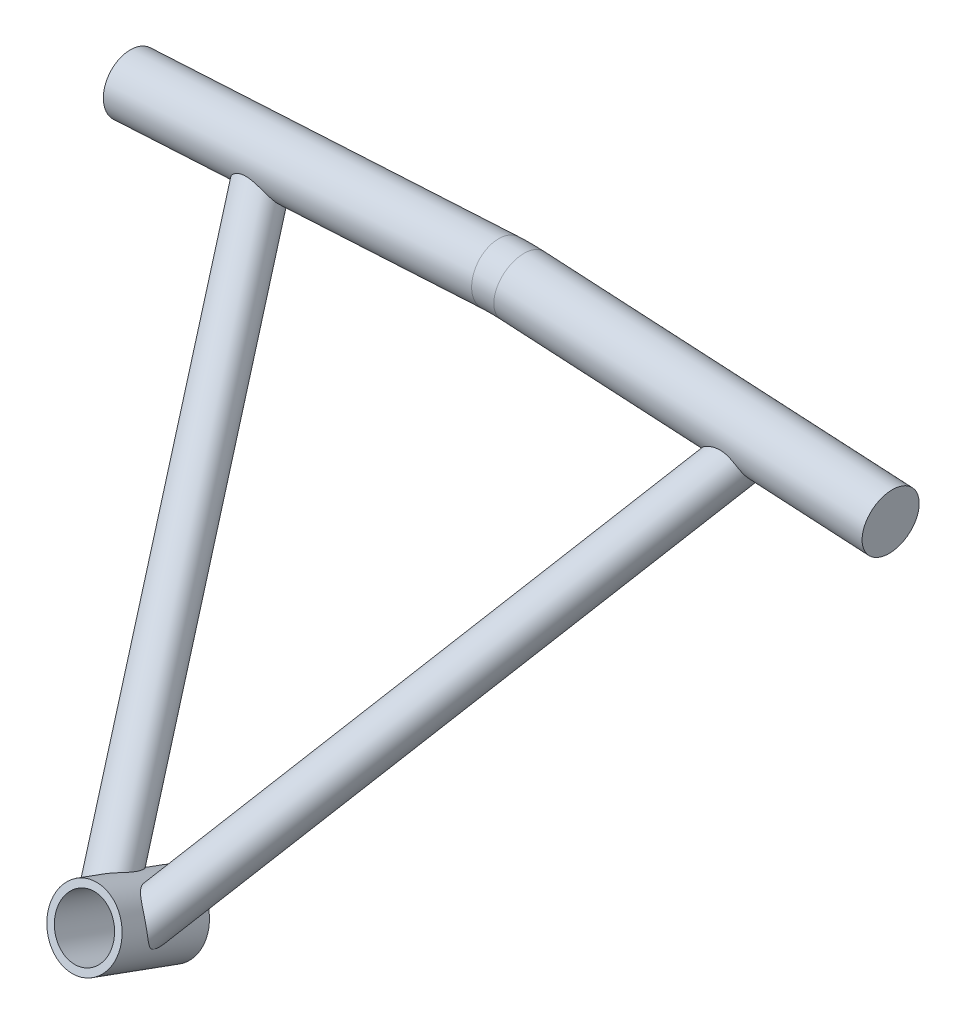
from build123d import *

# Parameters (mm, degrees)
SKETCH1_R           = 15.875
BOSS_EXTRUDE1_DEPTH = 20.701
SWEEP1_PROFILE_R    = 9.525
SWEEP2_PROFILE_R    = 9.525
CUT_EXTRUDE1_REACH  = 255.716
SKETCH2_R           = 12.7
SKETCH36_R          = 7.9375
CUT_EXTRUDE2_DEPTH  = 127
SKETCH37_R          = 7.9375
CUT_EXTRUDE3_DEPTH  = 127
SWEEP3_PROFILE_R    = 12.7


with BuildPart() as part:
    # Sketch1 → Boss-Extrude1 (new, symmetric)
    with BuildSketch(Plane(origin=(0, 0, 0), x_dir=(1, 0, 0), z_dir=(0, 0.34202014332566943, 0.9396926207859081))):
        with Locations(Location((0, 0, 0), (0, 0, 270))):
            Circle(SKETCH1_R)
    extrude(amount=BOSS_EXTRUDE1_DEPTH, both=True)

    # Sweep1: sweep along a path in Sketch4
    with BuildLine(Plane(origin=(0, 3.144101118, 2.733125404), x_dir=(1, 0, 0), z_dir=(0, 0.7547095802227732, 0.6560590289905059))) as sweep1_path:
        Line((-5.08, -4.792405834), (-106.583162963, 223.187430848))
    # Sweep1 profile (on start of the path) → Sweep1 (sweep)
    with BuildSketch(Plane(origin=(-5.08, 0, 6.35), x_dir=(0, -0.7547095802227732, -0.656059028990506), z_dir=(-0.406736643075801, 0.5993397458796919, -0.6894615088518683))):
        Circle(SWEEP1_PROFILE_R)
    sweep(path=sweep1_path.line)

    # Sweep2: sweep along a path in Sketch15
    with BuildLine(Plane(origin=(0, 3.144101118, 2.733125404), x_dir=(1, 0, 0), z_dir=(0, 0.7547095802227732, 0.6560590289905059))) as sweep2_path:
        Line((5.08, -4.792405834), (107.099718499, 224.347633579))
    # Sweep2 profile (on start of the path) → Sweep2 (sweep)
    with BuildSketch(Plane(origin=(5.08, 0, 6.35), x_dir=(0, -0.7547095802227732, -0.6560590289905059), z_dir=(0.4067366430758011, 0.5993397458796919, -0.6894615088518683))):
        Circle(SWEEP2_PROFILE_R)
    sweep(path=sweep2_path.line)

    # Sketch2 → Cut-Extrude1 (cut, up to next)
    with BuildSketch(Plane(origin=(0, -7.080158987, -19.452576943), x_dir=(-1, 0, 0), z_dir=(0, -0.34202014332566943, -0.9396926207859081)), mode=Mode.PRIVATE) as cut_extrude1_sk1:
        with Locations(Location((0, 0, 0), (0, 0, 90))):
            Circle(SKETCH2_R)
    cut_extrude1_tool1 = extrude(cut_extrude1_sk1.sketch, amount=-CUT_EXTRUDE1_REACH, mode=Mode.PRIVATE) & part.part
    add(cut_extrude1_tool1.solids().sort_by_distance((0, -7.080159, -19.452577))[0], mode=Mode.SUBTRACT)

    # Sketch36 → Cut-Extrude2 (cut)
    with BuildSketch(Plane(origin=(-100.562845424, 148.182641636, -170.464629437), x_dir=(0.9116799149626169, 0.3145053776413387, -0.264435436521724), z_dir=(-0.40673664307580115, 0.599339745879692, -0.6894615088518682))):
        with Locations(Location((-6.31049899, -4.578407264, 0), (0, 0, 273.662259186))):
            Circle(SKETCH36_R)
    extrude(amount=-CUT_EXTRUDE2_DEPTH, mode=Mode.SUBTRACT)

    # Sketch37 → Cut-Extrude3 (cut)
    with BuildSketch(Plane(origin=(101.079400961, 148.943803114, -171.340245553), x_dir=(0.9116799149626169, -0.31450537764133857, 0.2644354365217239), z_dir=(0.40673664307580104, 0.5993397458796917, -0.6894615088518683))):
        with Locations(Location((6.31049899, -4.578407264, 0), (0, 0, 266.337740814))):
            Circle(SKETCH37_R)
    extrude(amount=-CUT_EXTRUDE3_DEPTH, mode=Mode.SUBTRACT)

    # Sweep3: sweep along a path in Sketch40
    with BuildLine(Plane(origin=(-106.934, 0, -170.688), x_dir=(1, 0, 0), z_dir=(0, 0, 1))) as sweep3_path:
        Line((-62.089448271, 153.292042412), (101.994706052, 162.422680082))
        ThreePointArc((101.994706052, 162.422680082), (106.934, 162.56), (111.873293948, 162.422680082))
        Line((111.873293948, 162.422680082), (275.957448271, 153.292042412))
    # Sweep3 profile (on start of the path) → Sweep3 (sweep)
    with BuildSketch(Plane(origin=(-169.023448271, 153.292042412, -170.688), x_dir=(-0.055560111902353555, 0.9984553440016224, 0), z_dir=(0.9984553440016224, 0.055560111902353555, 0))):
        Circle(SWEEP3_PROFILE_R)
    sweep(path=sweep3_path.line)


solid = part.part
